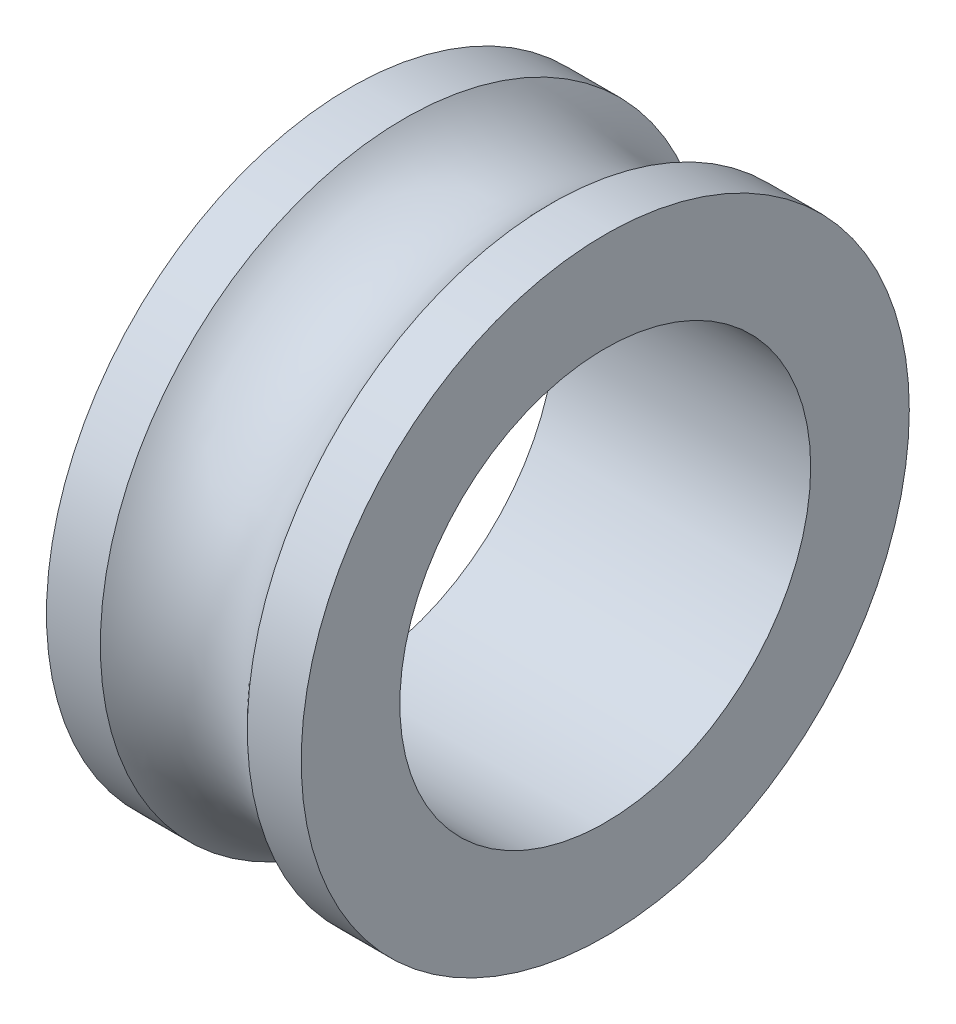
from build123d import *


with BuildPart() as part:
    # Sketch3 → Revolve1 (revolve)
    with BuildSketch(Plane.XY, mode=Mode.PRIVATE) as revolve1_sk:
        with BuildLine():
            Line((15.5, 37), (8.94427191, 37))
            ThreePointArc((8.94427191, 37), (0, 33), (-8.94427191, 37))
            Line((-8.94427191, 37), (-15.5, 37))
            Line((-15.5, 37), (-15.5, 25))
            Line((-15.5, 25), (15.5, 25))
            Line((15.5, 25), (15.5, 37))
        make_face()
    revolve(revolve1_sk.sketch.rotate(Axis((49.788918206, 0, 0), (-1, 0, 0)), 90), axis=Axis((49.788918206, 0, 0), (-1, 0, 0)))


solid = part.part
